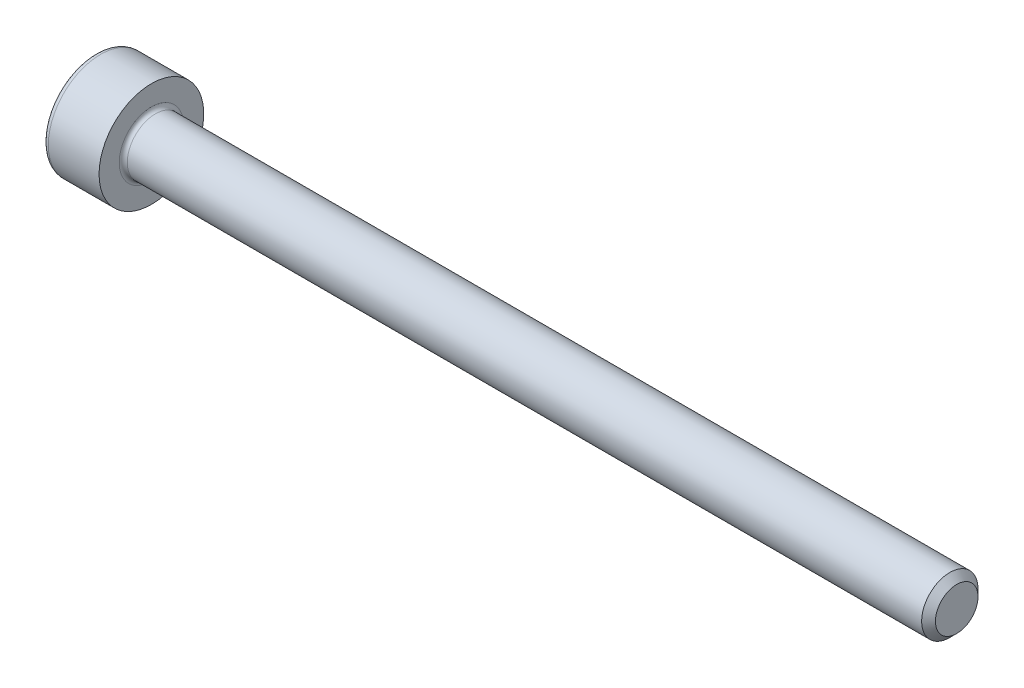
from build123d import *

# Parameters (mm, degrees)
FILLET1_R   = 0.1
FILLET2_R   = 0.14
HEX_2_DEPTH = 0.6


with BuildPart() as part:
    # BodySke → Base-Revolve (revolve)
    with BuildSketch(Plane.XY, mode=Mode.PRIVATE) as base_revolve_sk:
        Polygon((0, 0), (0, 1.3), (1.4, 1.3), (1.4, 0.7), (21.2285, 0.7), (21.4, 0.5285), (21.4, 0), align=None)
    revolve(base_revolve_sk.sketch.rotate(Axis((-31.75, 0, 0), (1, 0, 0)), 90), axis=Axis((-31.75, 0, 0), (1, 0, 0)))

    # Fillet1
    fillet1_edges = [part.edges().sort_by_distance(p)[0] for p in [
        (1.4, 0, -0.7),
    ]]
    fillet(fillet1_edges, radius=FILLET1_R)

    # Fillet2
    fillet2_edges = [part.edges().sort_by_distance(p)[0] for p in [
        (0, 0, -1.3),
    ]]
    fillet(fillet2_edges, radius=FILLET2_R)

    # Sketch2 → Hex-PreBroach (revolve, cut)
    with BuildSketch(Plane.XY, mode=Mode.PRIVATE) as hex_prebroach_sk:
        Polygon((0, 0.66), (0.6, 0.66), (0.981051178, 0), (0, 0), align=None)
    revolve(hex_prebroach_sk.sketch.rotate(Axis((0, 0, 0), (1, 0, 0)), 90), axis=Axis((0, 0, 0), (1, 0, 0)), mode=Mode.SUBTRACT)

    # Sketch3 → Hex 2 (cut)
    with BuildSketch(Plane(origin=(0, 0, 0), x_dir=(0, 0.500000000000001, 0.866025403784438), z_dir=(-1, 0, 0))):
        Polygon((0.381051178, 0.66), (-0.381051178, 0.66), (-0.762102355, 0), (-0.381051178, -0.66), (0.381051178, -0.66), (0.762102355, 0), align=None)
    extrude(amount=-HEX_2_DEPTH, mode=Mode.SUBTRACT)


solid = part.part
